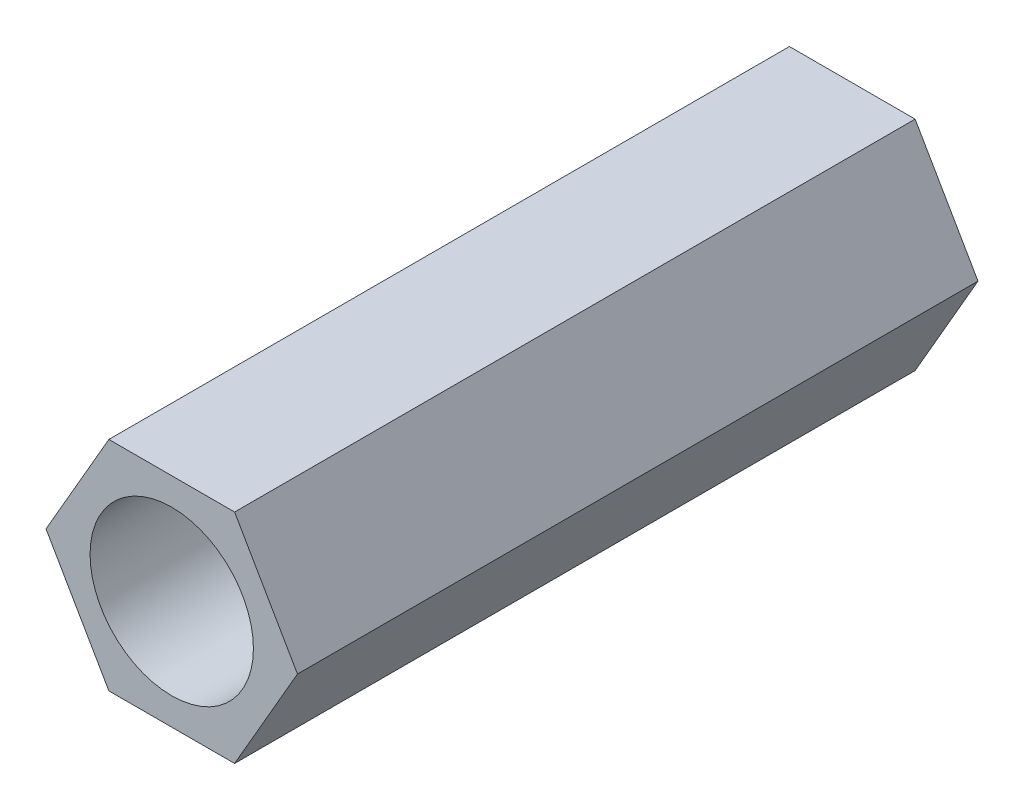
from build123d import *

# Parameters (mm, degrees)
SKETCH_1_R      = 1.5
EXTRUDE_1_DEPTH = 12.5


with BuildPart() as part:
    # 草图1 → 凸台-拉伸1 (new body)
    with BuildSketch(Plane.XY):
        Polygon((2.309401077, 0), (1.154700538, 2), (-1.154700538, 2), (-2.309401077, 0), (-1.154700538, -2), (1.154700538, -2), align=None)
        Circle(SKETCH_1_R, mode=Mode.SUBTRACT)
    extrude(amount=EXTRUDE_1_DEPTH)


solid = part.part
